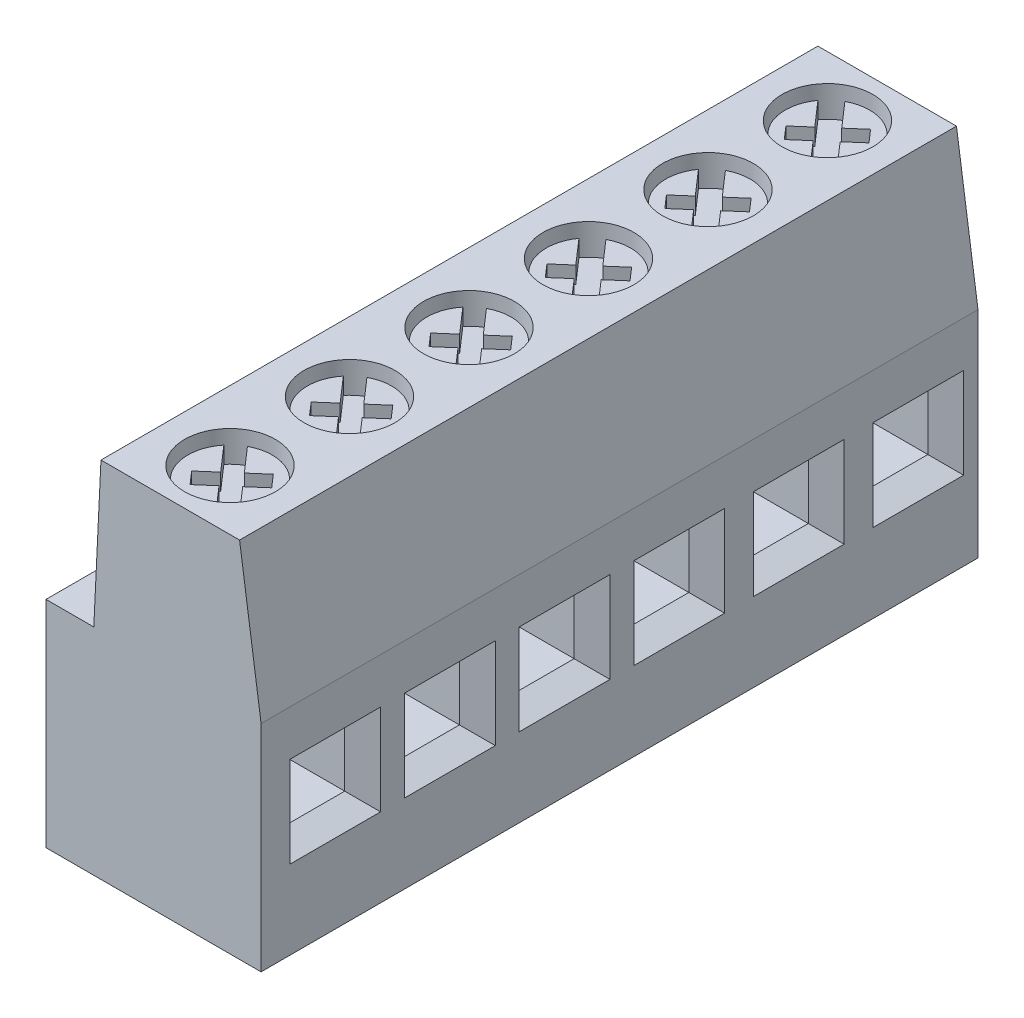
from build123d import *
from build123d.topology import SkipClean

# Parameters (mm, degrees)
BOSS_EXTRUDE1_DEPTH            = 30
F_3_8_3_8_DIAMETER_HOLE1_D     = 3.8
F_3_8_3_8_DIAMETER_HOLE1_DEPTH = 8
SKETCH4_R                      = 1.765955092
BOSS_EXTRUDE2_DEPTH            = 7.5
CUT_EXTRUDE1_START             = -0.7
CUT_EXTRUDE1_DEPTH             = 0.7
SKETCH6_W                      = 0.7
SKETCH6_H                      = 0.7
CUT_EXTRUDE2_DEPTH             = 0.855819983
BOSS_EXTRUDE3_DEPTH            = 0.7
CUT_EXTRUDE3_DEPTH             = 0.7
F_3_8_3_8_DIAMETER_HOLE2_D     = 3.8
F_3_8_3_8_DIAMETER_HOLE2_DEPTH = 8
SKETCH11_R                     = 1.765955092
BOSS_EXTRUDE4_DEPTH            = 7.5
CUT_EXTRUDE4_START             = -0.7
CUT_EXTRUDE4_DEPTH             = 0.7
SKETCH13_W                     = 0.7
SKETCH13_H                     = 0.7
CUT_EXTRUDE5_DEPTH             = 0.855819983
BOSS_EXTRUDE5_DEPTH            = 0.7
CUT_EXTRUDE6_DEPTH             = 0.7
F_3_8_3_8_DIAMETER_HOLE3_D     = 3.8
F_3_8_3_8_DIAMETER_HOLE3_DEPTH = 8
SKETCH18_R                     = 1.765955092
BOSS_EXTRUDE6_DEPTH            = 7.5
CUT_EXTRUDE7_START             = -0.7
CUT_EXTRUDE7_DEPTH             = 0.7
SKETCH20_W                     = 0.7
SKETCH20_H                     = 0.7
CUT_EXTRUDE8_DEPTH             = 0.855819983
BOSS_EXTRUDE7_DEPTH            = 0.7
CUT_EXTRUDE9_DEPTH             = 0.7
SKETCH23_W                     = 2.3
SKETCH23_H                     = 6.2
CUT_EXTRUDE10_DEPTH            = 35.814364851
SKETCH24_W                     = 0.8
SKETCH24_H                     = 1
BOSS_EXTRUDE8_DEPTH            = 3.5
SKETCH25_W                     = 0.8
SKETCH25_H                     = 1
BOSS_EXTRUDE9_DEPTH            = 3.5
SKETCH26_W                     = 0.8
SKETCH26_H                     = 1
BOSS_EXTRUDE10_DEPTH           = 3.5
SKETCH27_W                     = 2.8
SKETCH27_H                     = 2.8
CUT_EXTRUDE11_DEPTH            = 8
SKETCH28_W                     = 2.8
SKETCH28_H                     = 2.8
CUT_EXTRUDE12_DEPTH            = 8
SKETCH29_W                     = 2.8
SKETCH29_H                     = 2.8
CUT_EXTRUDE13_DEPTH            = 8
DRAFT1_ANGLE                   = 2.770215797
CHAMFER1_SIZE                  = 0.5
CHAMFER1_SIZE2                 = 1
SKETCH31_W                     = 0.8
SKETCH31_H                     = 1
BOSS_EXTRUDE11_DEPTH           = 3.5
SKETCH32_W                     = 0.8
SKETCH32_H                     = 1
BOSS_EXTRUDE12_DEPTH           = 3.5
SKETCH34_W                     = 0.8
SKETCH34_H                     = 1
BOSS_EXTRUDE13_DEPTH           = 3.5
SKETCH35_W                     = 2.8
SKETCH35_H                     = 2.8
CUT_EXTRUDE14_DEPTH            = 8
SKETCH36_W                     = 2.8
SKETCH36_H                     = 2.8
CUT_EXTRUDE15_DEPTH            = 8
SKETCH37_W                     = 2.8
SKETCH37_H                     = 2.8
CUT_EXTRUDE16_DEPTH            = 8
CHAMFER2_SIZE                  = 0.5
CHAMFER2_SIZE2                 = 1
F_3_8_3_8_DIAMETER_HOLE4_D     = 3.8
F_3_8_3_8_DIAMETER_HOLE4_DEPTH = 8
F_3_8_3_8_DIAMETER_HOLE5_D     = 3.8
F_3_8_3_8_DIAMETER_HOLE5_DEPTH = 8
F_3_8_3_8_DIAMETER_HOLE6_D     = 3.8
F_3_8_3_8_DIAMETER_HOLE6_DEPTH = 8
SKETCH74_R                     = 1.765
BOSS_EXTRUDE20_DEPTH           = 7.5
SKETCH75_R                     = 1.765
BOSS_EXTRUDE21_DEPTH           = 7.5
SKETCH76_R                     = 1.765
BOSS_EXTRUDE22_DEPTH           = 7.5
CUT_EXTRUDE27_DEPTH            = 0.7
CUT_EXTRUDE28_START            = -0.7
CUT_EXTRUDE28_DEPTH            = 0.7
CUT_EXTRUDE29_START            = -0.7
CUT_EXTRUDE29_DEPTH            = 0.7


with BuildPart() as part:
    # Sketch1 → Boss-Extrude1 (new body)
    with BuildSketch(Plane(origin=(0, 0, -15), x_dir=(-1, 0, 0), z_dir=(0, 0, -1))):
        Polygon((-9, 0), (0, 0), (0, 15.2), (-8.1, 15.2), (-9, 9), align=None)
    extrude(amount=-BOSS_EXTRUDE1_DEPTH)

    # Ø3.8 (3.8) Diameter Hole1
    with Locations(Plane(origin=(0, 15.2, 0), x_dir=(1, 0, 0), z_dir=(0, 1, 0))):
        with Locations((5.2, 7.5)):
            Hole(F_3_8_3_8_DIAMETER_HOLE1_D / 2, depth=F_3_8_3_8_DIAMETER_HOLE1_DEPTH)

    # Sketch4 → Boss-Extrude2 (add)
    with BuildSketch(Plane(origin=(0, 7.2, 0), x_dir=(-1, 0, 0), z_dir=(0, 1, 0))):
        with Locations(Location((-5.2, -7.5, 0), (0, 0, 270))):
            Circle(SKETCH4_R)
    extrude(amount=BOSS_EXTRUDE2_DEPTH)

    # Sketch5 → Cut-Extrude1 (cut)
    with BuildSketch(Plane(origin=(0, 14.7, 0), x_dir=(-1, 0, 0), z_dir=(0, 1, 0)).offset(CUT_EXTRUDE1_START)):
        with BuildLine():
            Line((-3.768061814, -8.533513627), (-6.028980452, -5.940708881))
            ThreePointArc((-6.028980452, -5.940708881), (-6.530995349, -8.6606243), (-3.768061814, -8.533513627))
        make_face()
    extrude(amount=CUT_EXTRUDE1_DEPTH, mode=Mode.SUBTRACT)

    # Sketch6 → Cut-Extrude2 (cut)
    with BuildSketch(Plane(origin=(6.36752705, 0, -5.552466151), x_dir=(-0.6572218656049325, 0, -0.7536971668851967), z_dir=(0.7536971668851967, 0, -0.6572218656049325))):
        with Locations((2.23517505, 14.35)):
            Rectangle(SKETCH6_W, SKETCH6_H)
    extrude(amount=-CUT_EXTRUDE2_DEPTH, mode=Mode.SUBTRACT)

    # Sketch7 → Boss-Extrude3 (add)
    with BuildSketch(Plane(origin=(0, 14, 0), x_dir=(-1, 0, 0), z_dir=(0, 1, 0))):
        with BuildLine():
            Line((-6.631938186, -6.466486373), (-4.371019548, -9.059291119))
            ThreePointArc((-4.371019548, -9.059291119), (-6.530995349, -8.6606243), (-6.631938186, -6.466486373))
        make_face()
    extrude(amount=BOSS_EXTRUDE3_DEPTH)

    # Sketch8 → Cut-Extrude3 (cut)
    with BuildSketch(Plane(origin=(0, 14.7, 0), x_dir=(-1, 0, 0), z_dir=(0, 1, 0))):
        Polygon((-5.73150652, -7.499094738), (-6.376535616, -8.061558344), (-5.916480311, -8.589146361), (-5.271451214, -8.026682755), align=None)
    extrude(amount=-CUT_EXTRUDE3_DEPTH, mode=Mode.SUBTRACT)

    # Ø3.8 (3.8) Diameter Hole2
    with Locations(Plane(origin=(0, 15.2, 0), x_dir=(1, 0, 0), z_dir=(0, 1, 0))):
        with Locations((5.2, 2.5)):
            Hole(F_3_8_3_8_DIAMETER_HOLE2_D / 2, depth=F_3_8_3_8_DIAMETER_HOLE2_DEPTH)

    # Sketch11 → Boss-Extrude4 (add)
    with BuildSketch(Plane(origin=(0, 7.2, 0), x_dir=(-1, 0, 0), z_dir=(0, 1, 0))):
        with Locations(Location((-5.2, -2.5, 0), (0, 0, 270))):
            Circle(SKETCH11_R)
    extrude(amount=BOSS_EXTRUDE4_DEPTH)

    # Sketch12 → Cut-Extrude4 (cut)
    with BuildSketch(Plane(origin=(0, 14.7, 0), x_dir=(-1, 0, 0), z_dir=(0, 1, 0)).offset(CUT_EXTRUDE4_START)):
        with BuildLine():
            Line((-6.631938186, -1.466486373), (-4.371019548, -4.059291119))
            ThreePointArc((-4.371019548, -4.059291119), (-3.869004651, -1.3393757), (-6.631938186, -1.466486373))
        make_face()
    extrude(amount=CUT_EXTRUDE4_DEPTH, mode=Mode.SUBTRACT)

    # Sketch13 → Cut-Extrude5 (cut)
    with BuildSketch(Plane(origin=(4.493753493, 0, -3.91854074), x_dir=(0.6572218656049327, 0, 0.7536971668851965), z_dir=(-0.7536971668851965, 0, 0.6572218656049327))):
        with Locations((1.533310784, 14.35)):
            Rectangle(SKETCH13_W, SKETCH13_H)
    extrude(amount=-CUT_EXTRUDE5_DEPTH, mode=Mode.SUBTRACT)

    # Sketch14 → Boss-Extrude5 (add)
    with SkipClean():  # the faces are left unmerged after this step: merging them gives an invalid solid
        with BuildSketch(Plane(origin=(0, 14, 0), x_dir=(-1, 0, 0), z_dir=(0, 1, 0))):
            with BuildLine():
                Line((-3.768061814, -3.533513627), (-6.028980452, -0.940708881))
                ThreePointArc((-6.028980452, -0.940708881), (-3.869004651, -1.3393757), (-3.768061814, -3.533513627))
            make_face()
        extrude(amount=BOSS_EXTRUDE5_DEPTH)

    # Sketch15 → Cut-Extrude6 (cut)
    with SkipClean():  # the faces are left unmerged after this step: merging them gives an invalid solid
        with BuildSketch(Plane(origin=(0, 14.7, 0), x_dir=(-1, 0, 0), z_dir=(0, 1, 0))):
            Polygon((-4.66849348, -2.500905262), (-4.023464384, -1.938441656), (-4.483519689, -1.410853639), (-5.128548786, -1.973317245), align=None)
        extrude(amount=-CUT_EXTRUDE6_DEPTH, mode=Mode.SUBTRACT)

    # Ø3.8 (3.8) Diameter Hole3
    with Locations(Plane(origin=(0, 15.2, 0), x_dir=(1, 0, 0), z_dir=(0, 1, 0))):
        with Locations((5.2, 12.5)):
            Hole(F_3_8_3_8_DIAMETER_HOLE3_D / 2, depth=F_3_8_3_8_DIAMETER_HOLE3_DEPTH)

    # Sketch18 → Boss-Extrude6 (add)
    with SkipClean():  # the faces are left unmerged after this step: merging them gives an invalid solid
        with BuildSketch(Plane(origin=(0, 7.2, 0), x_dir=(-1, 0, 0), z_dir=(0, 1, 0))):
            with Locations(Location((-5.2, -12.5, 0), (0, 0, 270))):
                Circle(SKETCH18_R)
        extrude(amount=BOSS_EXTRUDE6_DEPTH)

    # Sketch19 → Cut-Extrude7 (cut)
    with SkipClean():  # the faces are left unmerged after this step: merging them gives an invalid solid
        with BuildSketch(Plane(origin=(0, 14.7, 0), x_dir=(-1, 0, 0), z_dir=(0, 1, 0)).offset(CUT_EXTRUDE7_START)):
            with BuildLine():
                Line((-3.768061814, -13.533513627), (-6.028980452, -10.940708881))
                ThreePointArc((-6.028980452, -10.940708881), (-6.530995349, -13.6606243), (-3.768061814, -13.533513627))
            make_face()
        extrude(amount=CUT_EXTRUDE7_DEPTH, mode=Mode.SUBTRACT)

    # Sketch20 → Cut-Extrude8 (cut)
    with SkipClean():  # the faces are left unmerged after this step: merging them gives an invalid solid
        with BuildSketch(Plane(origin=(8.84425834, 0, -7.712169054), x_dir=(-0.6572218656049325, 0, -0.7536971668851967), z_dir=(0.7536971668851967, 0, -0.6572218656049325))):
            with Locations((6.003660885, 14.35)):
                Rectangle(SKETCH20_W, SKETCH20_H)
        extrude(amount=-CUT_EXTRUDE8_DEPTH, mode=Mode.SUBTRACT)

    # Sketch21 → Boss-Extrude7 (add)
    with SkipClean():  # the faces are left unmerged after this step: merging them gives an invalid solid
        with BuildSketch(Plane(origin=(0, 14, 0), x_dir=(-1, 0, 0), z_dir=(0, 1, 0))):
            with BuildLine():
                Line((-6.631938186, -11.466486373), (-4.371019548, -14.059291119))
                ThreePointArc((-4.371019548, -14.059291119), (-6.530995349, -13.6606243), (-6.631938186, -11.466486373))
            make_face()
        extrude(amount=BOSS_EXTRUDE7_DEPTH)

    # Sketch22 → Cut-Extrude9 (cut)
    with SkipClean():  # the faces are left unmerged after this step: merging them gives an invalid solid
        with BuildSketch(Plane(origin=(0, 14.7, 0), x_dir=(-1, 0, 0), z_dir=(0, 1, 0))):
            Polygon((-5.73150652, -12.499094738), (-6.376535616, -13.061558344), (-5.916480311, -13.589146361), (-5.271451214, -13.026682755), align=None)
        extrude(amount=-CUT_EXTRUDE9_DEPTH, mode=Mode.SUBTRACT)

    # Sketch23 → Cut-Extrude10 (cut, through all)
    with SkipClean():  # the faces are left unmerged after this step: merging them gives an invalid solid
        with BuildSketch(Plane.XY.offset(15)):
            with Locations((1.15, 12.1)):
                Rectangle(SKETCH23_W, SKETCH23_H)
        extrude(amount=-CUT_EXTRUDE10_DEPTH, mode=Mode.SUBTRACT)

    # Sketch24 → Boss-Extrude8 (add)
    with SkipClean():  # the faces are left unmerged after this step: merging them gives an invalid solid
        with BuildSketch(Plane.XZ):
            with Locations((4.5, -12.5)):
                Rectangle(SKETCH24_W, SKETCH24_H)
        extrude(amount=BOSS_EXTRUDE8_DEPTH)

    # Sketch25 → Boss-Extrude9 (add)
    with SkipClean():  # the faces are left unmerged after this step: merging them gives an invalid solid
        with BuildSketch(Plane.XZ):
            with Locations((4.5, -7.5)):
                Rectangle(SKETCH25_W, SKETCH25_H)
        extrude(amount=BOSS_EXTRUDE9_DEPTH)

    # Sketch26 → Boss-Extrude10 (add)
    with SkipClean():  # the faces are left unmerged after this step: merging them gives an invalid solid
        with BuildSketch(Plane.XZ):
            with Locations((4.5, -2.5)):
                Rectangle(SKETCH26_W, SKETCH26_H)
        extrude(amount=BOSS_EXTRUDE10_DEPTH)

    # Sketch27 → Cut-Extrude11 (cut)
    with SkipClean():  # the faces are left unmerged after this step: merging them gives an invalid solid
        with BuildSketch(Plane(origin=(9, 0, 0), x_dir=(0, 0, -1), z_dir=(1, 0, 0))):
            with Locations((12.5, 5.2)):
                Rectangle(SKETCH27_W, SKETCH27_H)
        extrude(amount=-CUT_EXTRUDE11_DEPTH, mode=Mode.SUBTRACT)

    # Sketch28 → Cut-Extrude12 (cut)
    with SkipClean():  # the faces are left unmerged after this step: merging them gives an invalid solid
        with BuildSketch(Plane(origin=(9, 0, 0), x_dir=(0, 0, -1), z_dir=(1, 0, 0))):
            with Locations((7.5, 5.2)):
                Rectangle(SKETCH28_W, SKETCH28_H)
        extrude(amount=-CUT_EXTRUDE12_DEPTH, mode=Mode.SUBTRACT)

    # Sketch29 → Cut-Extrude13 (cut)
    with SkipClean():  # the faces are left unmerged after this step: merging them gives an invalid solid
        with BuildSketch(Plane(origin=(9, 0, 0), x_dir=(0, 0, -1), z_dir=(1, 0, 0))):
            with Locations((2.5, 5.2)):
                Rectangle(SKETCH29_W, SKETCH29_H)
        extrude(amount=-CUT_EXTRUDE13_DEPTH, mode=Mode.SUBTRACT)

    # Draft1
    draft1_faces = [part.faces().sort_by_distance(p)[0] for p in [
        (2.3, 12.1, 0),
    ]]
    draft(draft1_faces, Plane(origin=(0, 15.2, 15), x_dir=(1, 0, 0), z_dir=(0, 1, 0)), DRAFT1_ANGLE)

    # Chamfer1
    chamfer1_edges = [part.edges().sort_by_distance(p)[0] for p in [
        (9, 5.2, -13.9),
        (9, 6.6, -12.5),
        (9, 5.2, -11.1),
        (9, 3.8, -12.5),
        (9, 5.2, -8.9),
        (9, 6.6, -7.5),
        (9, 5.2, -6.1),
        (9, 3.8, -7.5),
        (9, 5.2, -3.9),
        (9, 6.6, -2.5),
        (9, 5.2, -1.1),
        (9, 3.8, -2.5),
    ]]
    chamfer1_side = [part.faces().sort_by_distance(p)[0] for p in [
        (9, 4.433203505, 0.715676728),
    ]]
    chamfer(chamfer1_edges, length=CHAMFER1_SIZE, length2=CHAMFER1_SIZE2, reference=chamfer1_side[0])

    # Sketch31 → Boss-Extrude11 (add)
    with SkipClean():  # the faces are left unmerged after this step: merging them gives an invalid solid
        with BuildSketch(Plane.XZ):
            with Locations((4.5, 2.5)):
                Rectangle(SKETCH31_W, SKETCH31_H)
        extrude(amount=BOSS_EXTRUDE11_DEPTH)

    # Sketch32 → Boss-Extrude12 (add)
    with SkipClean():  # the faces are left unmerged after this step: merging them gives an invalid solid
        with BuildSketch(Plane.XZ):
            with Locations((4.5, 6.5)):
                Rectangle(SKETCH32_W, SKETCH32_H)
        extrude(amount=BOSS_EXTRUDE12_DEPTH)

    # Sketch34 → Boss-Extrude13 (add)
    with SkipClean():  # the faces are left unmerged after this step: merging them gives an invalid solid
        with BuildSketch(Plane.XZ):
            with Locations((4.5, 10.5)):
                Rectangle(SKETCH34_W, SKETCH34_H)
        extrude(amount=BOSS_EXTRUDE13_DEPTH)

    # Sketch35 → Cut-Extrude14 (cut)
    with SkipClean():  # the faces are left unmerged after this step: merging them gives an invalid solid
        with BuildSketch(Plane(origin=(9, 0, 0), x_dir=(0, 0, -1), z_dir=(1, 0, 0))):
            with Locations((-2.3, 5.2)):
                Rectangle(SKETCH35_W, SKETCH35_H)
        extrude(amount=-CUT_EXTRUDE14_DEPTH, mode=Mode.SUBTRACT)

    # Sketch36 → Cut-Extrude15 (cut)
    with SkipClean():  # the faces are left unmerged after this step: merging them gives an invalid solid
        with BuildSketch(Plane(origin=(9, 0, 0), x_dir=(0, 0, -1), z_dir=(1, 0, 0))):
            with Locations((-7.1, 5.2)):
                Rectangle(SKETCH36_W, SKETCH36_H)
        extrude(amount=-CUT_EXTRUDE15_DEPTH, mode=Mode.SUBTRACT)

    # Sketch37 → Cut-Extrude16 (cut)
    with SkipClean():  # the faces are left unmerged after this step: merging them gives an invalid solid
        with BuildSketch(Plane(origin=(9, 0, 0), x_dir=(0, 0, -1), z_dir=(1, 0, 0))):
            with Locations((-11.9, 5.2)):
                Rectangle(SKETCH37_W, SKETCH37_H)
        extrude(amount=-CUT_EXTRUDE16_DEPTH, mode=Mode.SUBTRACT)

    # Chamfer2
    chamfer2_edges = [part.edges().sort_by_distance(p)[0] for p in [
        (9, 5.2, 0.9),
        (9, 6.6, 2.3),
        (9, 5.2, 3.7),
        (9, 3.8, 2.3),
        (9, 5.2, 5.7),
        (9, 6.6, 7.1),
        (9, 5.2, 8.5),
        (9, 3.8, 7.1),
        (9, 5.2, 10.5),
        (9, 6.6, 11.9),
        (9, 5.2, 13.3),
        (9, 3.8, 11.9),
    ]]
    chamfer2_side = [part.faces().sort_by_distance(p)[0] for p in [
        (9, 4.26969876, 0.777259303),
    ]]
    chamfer(chamfer2_edges, length=CHAMFER2_SIZE, length2=CHAMFER2_SIZE2, reference=chamfer2_side[0])

    # Ø3.8 (3.8) Diameter Hole4
    with Locations(Plane(origin=(0, 15.2, 0), x_dir=(1, 0, 0), z_dir=(0, 1, 0))):
        with Locations((5.2, -2.5)):
            Hole(F_3_8_3_8_DIAMETER_HOLE4_D / 2, depth=F_3_8_3_8_DIAMETER_HOLE4_DEPTH)

    # Ø3.8 (3.8) Diameter Hole5
    with Locations(Plane(origin=(0, 15.2, 0), x_dir=(1, 0, 0), z_dir=(0, 1, 0))):
        with Locations((5.2, -7.5)):
            Hole(F_3_8_3_8_DIAMETER_HOLE5_D / 2, depth=F_3_8_3_8_DIAMETER_HOLE5_DEPTH)

    # Ø3.8 (3.8) Diameter Hole6
    with Locations(Plane(origin=(0, 15.2, 0), x_dir=(1, 0, 0), z_dir=(0, 1, 0))):
        with Locations((5.2, -12.5)):
            Hole(F_3_8_3_8_DIAMETER_HOLE6_D / 2, depth=F_3_8_3_8_DIAMETER_HOLE6_DEPTH)

    # Sketch75 → Boss-Extrude21 (add)
    with SkipClean():  # the faces are left unmerged after this step: merging them gives an invalid solid
        with BuildSketch(Plane(origin=(0, 7.2, 0), x_dir=(1, 0, 0), z_dir=(0, 1, 0))):
            with Locations(Location((5.2, -7.5, 0), (0, 0, 90))):
                Circle(SKETCH75_R)
        extrude(amount=BOSS_EXTRUDE21_DEPTH)

    # Sketch76 → Boss-Extrude22 (add)
    with SkipClean():  # the faces are left unmerged after this step: merging them gives an invalid solid
        with BuildSketch(Plane(origin=(0, 7.2, 0), x_dir=(1, 0, 0), z_dir=(0, 1, 0))):
            with Locations(Location((5.2, -12.5, 0), (0, 0, 90))):
                Circle(SKETCH76_R)
        extrude(amount=BOSS_EXTRUDE22_DEPTH)

    # Sketch79 → Cut-Extrude28 (cut)
    with SkipClean():  # the faces are left unmerged after this step: merging them gives an invalid solid
        with BuildSketch(Plane(origin=(0, 14.7, 0), x_dir=(1, 0, 0), z_dir=(0, 1, 0)).offset(CUT_EXTRUDE28_START)):
            with BuildLine():
                Line((5.919593067, -6.408063195), (5.271413503, -6.973273999))
                Line((5.271413503, -6.973273999), (4.371664014, -5.94144795))
                ThreePointArc((4.371664014, -5.94144795), (4.078346019, -6.137239072), (3.82980799, -6.387435909))
                Line((3.82980799, -6.387435909), (4.742688618, -7.434320651))
                Line((4.742688618, -7.434320651), (4.094509055, -7.999531456))
                Line((4.094509055, -7.999531456), (4.554564361, -8.527119473))
                Line((4.554564361, -8.527119473), (5.202743924, -7.961908668))
                Line((5.202743924, -7.961908668), (6.115699973, -9.008879902))
                ThreePointArc((6.115699973, -9.008879902), (6.397398816, -8.79671164), (6.63129372, -8.532774558))
                Line((6.63129372, -8.532774558), (5.731468809, -7.500862016))
                Line((5.731468809, -7.500862016), (6.379648373, -6.935651212))
                Line((6.379648373, -6.935651212), (5.919593067, -6.408063195))
            make_face()
        extrude(amount=CUT_EXTRUDE28_DEPTH, mode=Mode.SUBTRACT)

    # Sketch80 → Cut-Extrude29 (cut)
    with SkipClean():  # the faces are left unmerged after this step: merging them gives an invalid solid
        with BuildSketch(Plane(origin=(0, 14.7, 0), x_dir=(1, 0, 0), z_dir=(0, 1, 0)).offset(CUT_EXTRUDE29_START)):
            with BuildLine():
                Line((5.919593067, -11.408063195), (5.271413503, -11.973273999))
                Line((5.271413503, -11.973273999), (4.371664014, -10.94144795))
                ThreePointArc((4.371664014, -10.94144795), (4.078346019, -11.137239072), (3.82980799, -11.387435909))
                Line((3.82980799, -11.387435909), (4.742688618, -12.434320651))
                Line((4.742688618, -12.434320651), (4.094509055, -12.999531456))
                Line((4.094509055, -12.999531456), (4.554564361, -13.527119473))
                Line((4.554564361, -13.527119473), (5.202743924, -12.961908668))
                Line((5.202743924, -12.961908668), (6.115699973, -14.008879902))
                ThreePointArc((6.115699973, -14.008879902), (6.397398816, -13.79671164), (6.63129372, -13.532774558))
                Line((6.63129372, -13.532774558), (5.731468809, -12.500862016))
                Line((5.731468809, -12.500862016), (6.379648373, -11.935651212))
                Line((6.379648373, -11.935651212), (5.919593067, -11.408063195))
            make_face()
        extrude(amount=CUT_EXTRUDE29_DEPTH, mode=Mode.SUBTRACT)


with BuildPart() as body_2:
    # Sketch74 → Boss-Extrude20 (new body)
    with BuildSketch(Plane(origin=(0, 7.2, 0), x_dir=(1, 0, 0), z_dir=(0, 1, 0))):
        with Locations(Location((5.2, -2.5, 0), (0, 0, 270))):
            Circle(SKETCH74_R)
    extrude(amount=BOSS_EXTRUDE20_DEPTH)

    # Sketch77 → Cut-Extrude27 (cut)
    with BuildSketch(Plane(origin=(0, 14.7, 0), x_dir=(1, 0, 0), z_dir=(0, 1, 0))):
        with BuildLine():
            Line((5.919593067, -1.408063195), (5.271413503, -1.973273999))
            Line((5.271413503, -1.973273999), (4.371664014, -0.94144795))
            ThreePointArc((4.371664014, -0.94144795), (4.078346019, -1.137239072), (3.82980799, -1.387435909))
            Line((3.82980799, -1.387435909), (4.742688618, -2.434320651))
            Line((4.742688618, -2.434320651), (4.094509055, -2.999531456))
            Line((4.094509055, -2.999531456), (4.554564361, -3.527119473))
            Line((4.554564361, -3.527119473), (5.202743924, -2.961908668))
            Line((5.202743924, -2.961908668), (6.115699973, -4.008879902))
            ThreePointArc((6.115699973, -4.008879902), (6.397398816, -3.79671164), (6.63129372, -3.532774558))
            Line((6.63129372, -3.532774558), (5.731468809, -2.500862016))
            Line((5.731468809, -2.500862016), (6.379648373, -1.935651212))
            Line((6.379648373, -1.935651212), (5.919593067, -1.408063195))
        make_face()
    extrude(amount=-CUT_EXTRUDE27_DEPTH, mode=Mode.SUBTRACT)


solid = Compound([part.part, body_2.part])
